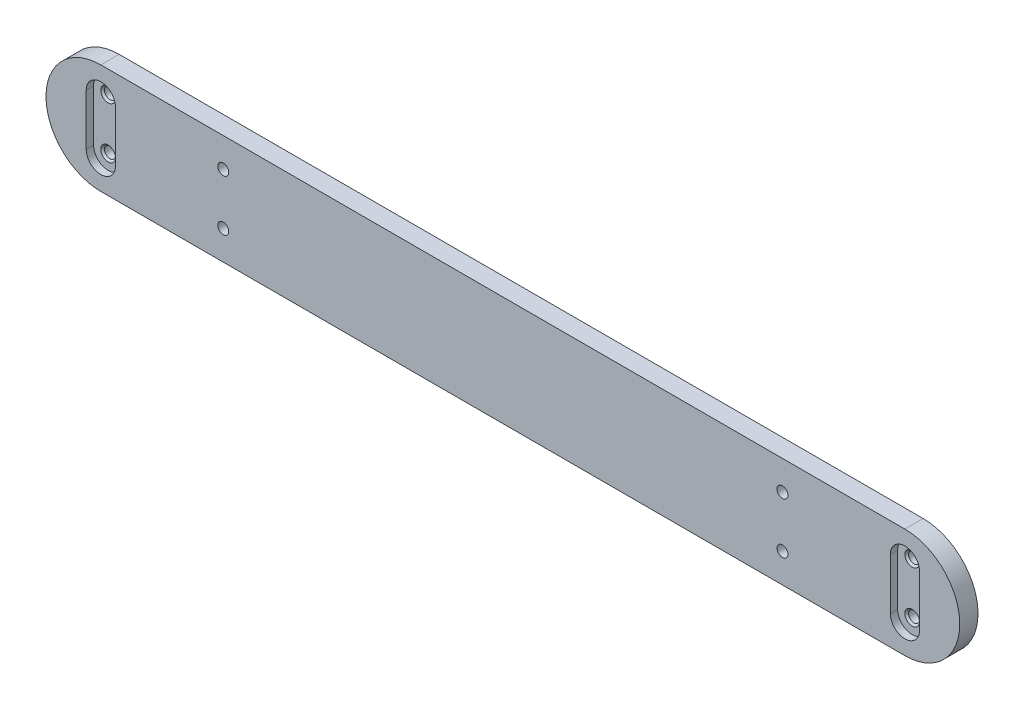
from build123d import *

# Parameters (mm, degrees)
EXTRUDE_1_DEPTH          = 5
CUT_EXTRUDE_1_DEPTH      = 2
CUT_EXTRUDE_2_DEPTH      = 2
CUT_EXTRUDE_4_DEPTH      = 126.932521614
CUT_EXTRUDE_4_DEPTH_BACK = 126.932521614
SKETCH_6_R               = 1.5
SKETCH_7_R               = 1.5
CUT_EXTRUDE_5_DEPTH      = 126.932521614
CHAMFER_1_SIZE           = 0.5
CHAMFER_2_SIZE           = 0.5


with BuildPart() as part:
    # 草图1 → 凸台-拉伸1 (new body)
    with BuildSketch(Plane.XY):
        with BuildLine():
            Line((-110, 15), (110, 15))
            ThreePointArc((110, 15), (125, 0), (110, -15))
            Line((110, -15), (-110, -15))
            ThreePointArc((-110, -15), (-125, 0), (-110, 15))
        make_face()
    extrude(amount=EXTRUDE_1_DEPTH)

    # 草图2 → 切除-拉伸1 (cut)
    with BuildSketch(Plane.XY.offset(5)):
        with BuildLine():
            Line((114, 7), (114, -7))
            ThreePointArc((114, -7), (110, -11), (106, -7))
            Line((106, -7), (106, 7))
            ThreePointArc((106, 7), (110, 11), (114, 7))
        make_face()
        with BuildLine():
            Line((-106, 7), (-106, -7))
            ThreePointArc((-106, -7), (-110, -11), (-114, -7))
            Line((-114, -7), (-114, 7))
            ThreePointArc((-114, 7), (-110, 11), (-106, 7))
        make_face()
    extrude(amount=-CUT_EXTRUDE_1_DEPTH, mode=Mode.SUBTRACT)

    # 草图4 → 切除-拉伸2 (cut)
    with BuildSketch(Plane(origin=(0, 0, 0), x_dir=(-1, 0, 0), z_dir=(0, 0, -1))):
        with BuildLine():
            Line((-71.5, 7.5), (-71.5, -7.5))
            ThreePointArc((-71.5, -7.5), (-76.5, -12.5), (-81.5, -7.5))
            Line((-81.5, -7.5), (-81.5, 7.5))
            ThreePointArc((-81.5, 7.5), (-76.5, 12.5), (-71.5, 7.5))
        make_face()
        with BuildLine():
            Line((71.5, 7.5), (71.5, -7.5))
            ThreePointArc((71.5, -7.5), (76.5, -12.5), (81.5, -7.5))
            Line((81.5, -7.5), (81.5, 7.5))
            ThreePointArc((81.5, 7.5), (76.5, 12.5), (71.5, 7.5))
        make_face()
    extrude(amount=-CUT_EXTRUDE_2_DEPTH, mode=Mode.SUBTRACT)

    # 草图6 → 切除-拉伸4 (cut, two sides: drawn at the far end of the back side and taken through both)
    with BuildSketch(Plane(origin=(0, 0, 2), x_dir=(-1, 0, 0), z_dir=(0, 0, -1)).offset(-CUT_EXTRUDE_4_DEPTH_BACK)):
        with Locations((76.5, 7)):
            Circle(SKETCH_6_R)
        with Locations(Location((76.5, -7, 0), (0, 0, 180))):
            Circle(SKETCH_6_R)
        with Locations((-76.5, 7)):
            Circle(SKETCH_6_R)
        with Locations((-76.5, -7)):
            Circle(SKETCH_6_R)
    extrude(amount=CUT_EXTRUDE_4_DEPTH + CUT_EXTRUDE_4_DEPTH_BACK, mode=Mode.SUBTRACT)

    # 草图7 → 切除-拉伸5 (cut, through all)
    with BuildSketch(Plane.XY.offset(3)):
        with Locations((110, 7)):
            Circle(SKETCH_7_R)
        with Locations((110, -7)):
            Circle(SKETCH_7_R)
        with Locations((-110, 7)):
            Circle(SKETCH_7_R)
        with Locations((-110, -7)):
            Circle(SKETCH_7_R)
    extrude(amount=-CUT_EXTRUDE_5_DEPTH, mode=Mode.SUBTRACT)

    # 倒角1
    chamfer_1_edges = [part.edges().sort_by_distance(p)[0] for p in [
        (108.5, -7, 3),
        (-111.5, 7, 3),
        (-111.5, -7, 3),
        (108.5, 7, 3),
    ]]
    chamfer(chamfer_1_edges, length=CHAMFER_1_SIZE)

    # 倒角2
    chamfer_2_edges = [part.edges().sort_by_distance(p)[0] for p in [
        (-78, -7, 2),
        (78, 7, 2),
        (78, -7, 2),
        (-75, 7, 2),
    ]]
    chamfer(chamfer_2_edges, length=CHAMFER_2_SIZE)


solid = part.part
